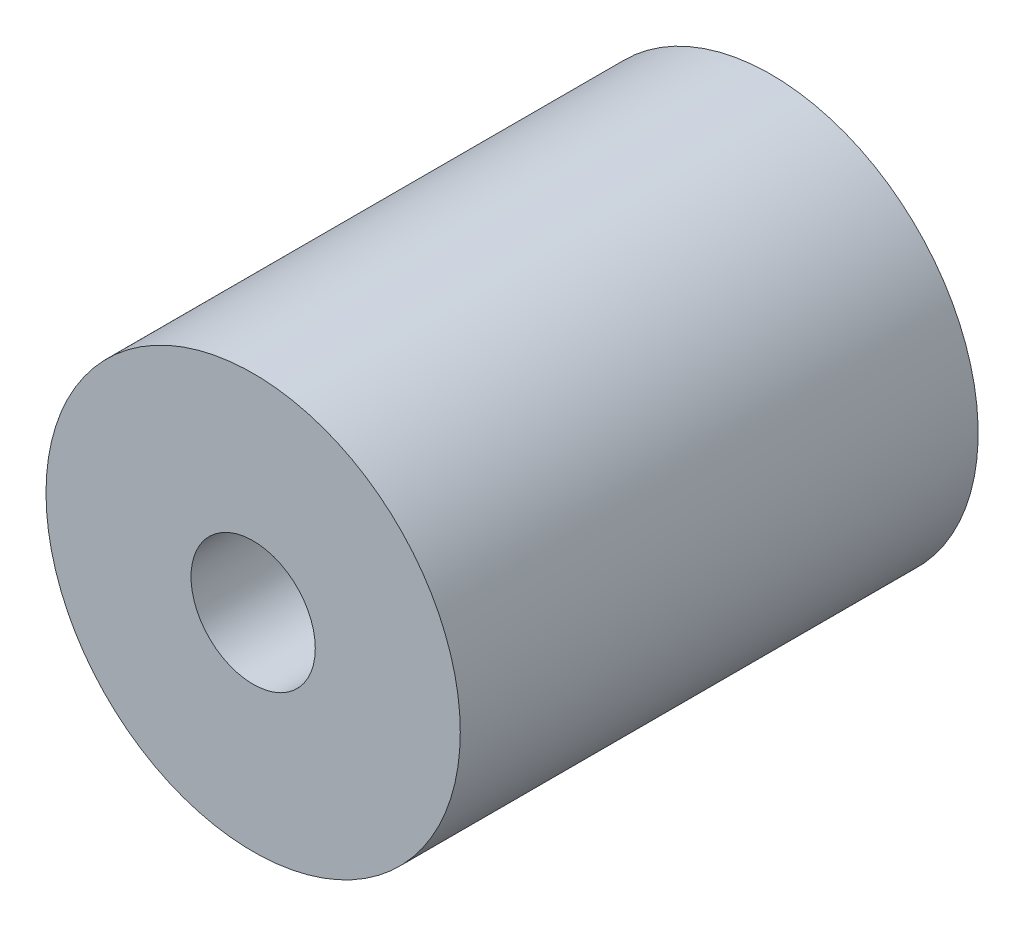
from build123d import *

# Parameters (mm, degrees)
SKETCH1_R           = 10
SKETCH1_R_2         = 3
BOSS_EXTRUDE1_DEPTH = 10
BOSS_EXTRUDE3_START = 5
SKETCH4_R           = 10
BOSS_EXTRUDE3_DEPTH = 5
BOSS_EXTRUDE4_START = 10
SKETCH5_R           = 10
SKETCH5_R_2         = 3
BOSS_EXTRUDE4_DEPTH = 10


with BuildPart() as part:
    # Sketch1 → Boss-Extrude1 (new body)
    with BuildSketch(Plane.XY):
        Circle(SKETCH1_R)
        Circle(SKETCH1_R_2, mode=Mode.SUBTRACT)
    extrude(amount=BOSS_EXTRUDE1_DEPTH)

    # Sketch4 → Boss-Extrude3 (add)
    with BuildSketch(Plane(origin=(0, 0, 0), x_dir=(-1, 0, 0), z_dir=(0, 0, -1)).offset(BOSS_EXTRUDE3_START)):
        Circle(SKETCH4_R)
    extrude(amount=-BOSS_EXTRUDE3_DEPTH)

    # Sketch5 → Boss-Extrude4 (add)
    with BuildSketch(Plane(origin=(0, 0, -5), x_dir=(-1, 0, 0), z_dir=(0, 0, -1)).offset(BOSS_EXTRUDE4_START)):
        Circle(SKETCH5_R)
        with Locations(Location((0, 0, 0), (0, 0, 180))):
            Circle(SKETCH5_R_2, mode=Mode.SUBTRACT)
    extrude(amount=-BOSS_EXTRUDE4_DEPTH)


solid = part.part
